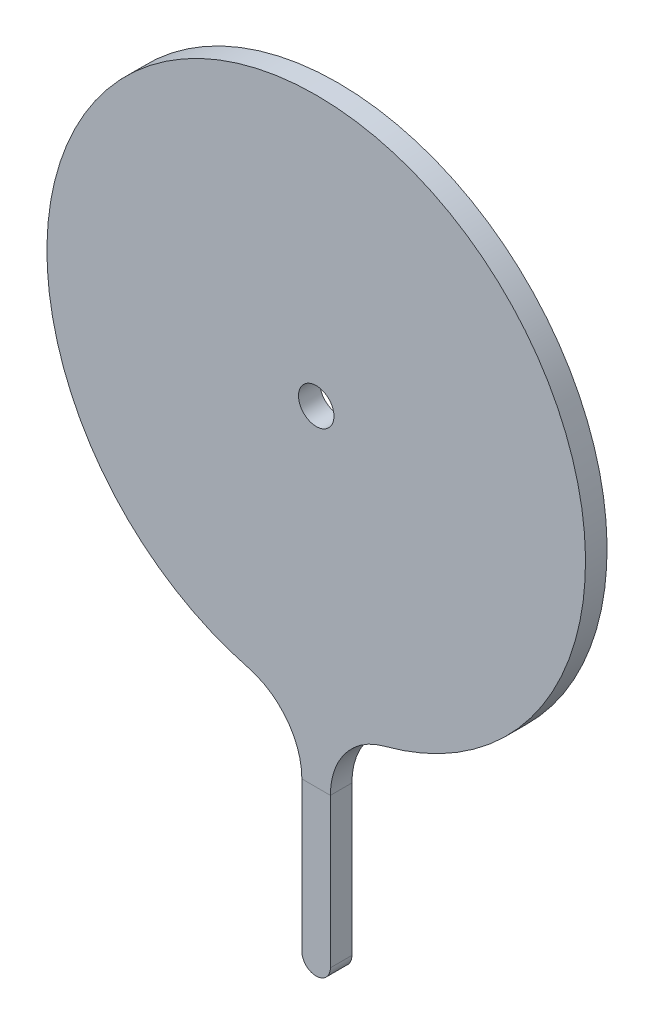
from build123d import *

# Parameters (mm, degrees)
SKETCH1_R           = 0.627
BOSS_EXTRUDE1_DEPTH = 0.762
FILLET1_R           = 2.54
FILLET2_RADIUS      = 0.5039995
FILLET2_LENGTH      = 0.762


with BuildPart() as part:
    # Sketch1 → Boss-Extrude1 (new body)
    with BuildSketch(Plane.XY):
        with BuildLine():
            Line((-0.508, -9.511443686), (-0.508, -17.4625))
            Line((-0.508, -17.4625), (0.499999, -17.4625))
            Line((0.499999, -17.4625), (0.499999, -9.51186764))
            ThreePointArc((0.499999, -9.51186764), (0.004006112, 9.524999158), (-0.508, -9.511443686))
        make_face()
        Circle(SKETCH1_R, mode=Mode.SUBTRACT)
    extrude(amount=BOSS_EXTRUDE1_DEPTH)

    # Fillet1
    fillet1_edges = [part.edges().sort_by_distance(p)[0] for p in [
        (0.499999, -9.51186764, 0.381),
        (-0.508, -9.511443686, 0.381),
    ]]
    fillet(fillet1_edges, radius=FILLET1_R)

    # Fillet2: full round fillet: the end face becomes a half cylinder, R = half its width
    fillet2_face = Plane((-0.0040005, -17.4625, 0.381), x_dir=(0, 0, 1), z_dir=(0, -1, 0))  # on the end face: x along it, z out of the body
    fillet2_slab = fillet2_face.offset(-FILLET2_RADIUS / 2) * Box(FILLET2_LENGTH, 2 * FILLET2_RADIUS, FILLET2_RADIUS, mode=Mode.PRIVATE)  # the body's end, R deep
    fillet2_round = Plane((-0.0040005, -16.9585005, 0.381), x_dir=(0, -1, 0), z_dir=(0, 0, 1)) * Cylinder(FILLET2_RADIUS, FILLET2_LENGTH, mode=Mode.PRIVATE)  # its axis R under the face
    add(fillet2_slab - fillet2_round, mode=Mode.SUBTRACT)


solid = part.part
